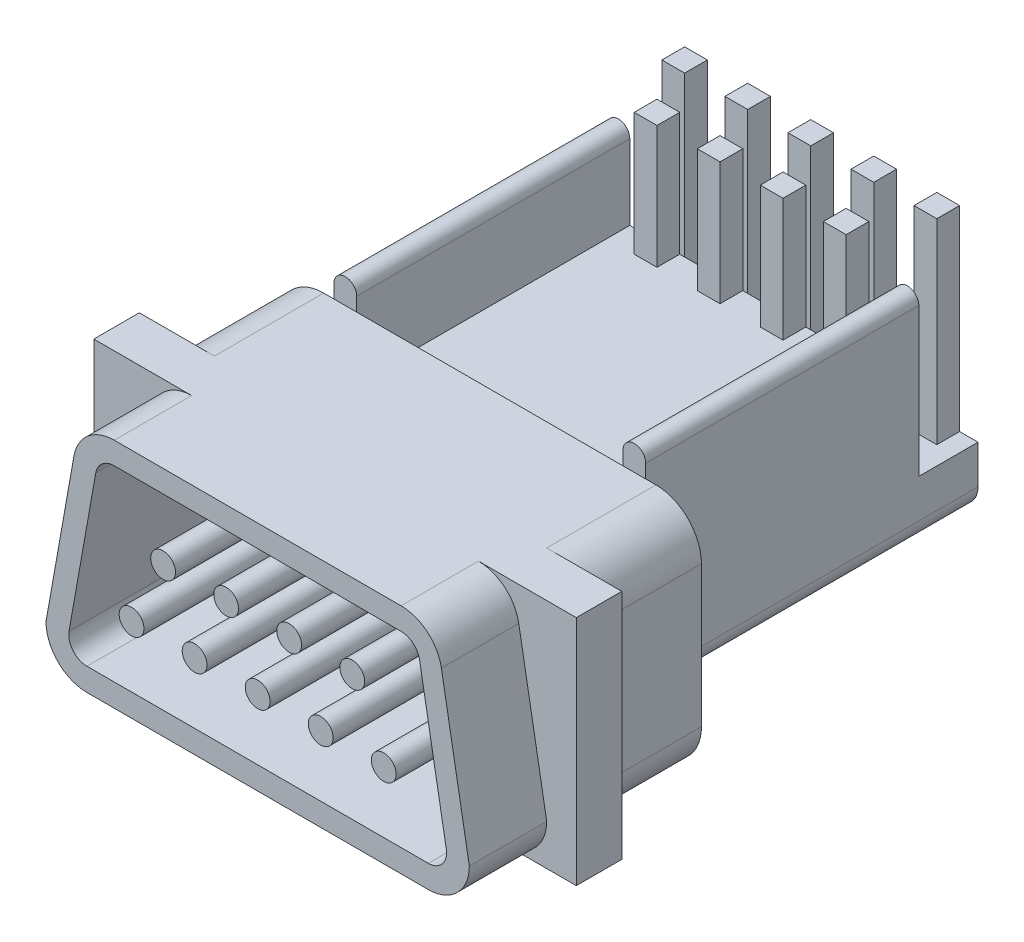
from build123d import *

# Parameters (mm, degrees)
SKETCH_1_W          = 21.2
SKETCH_1_H          = 10.2
EXTRUDE_1_DEPTH     = 2
EXTRUDE_2_DEPTH     = 3.4
EXTRUDE_3_DEPTH     = 4.8
EXTRUDE_4_DEPTH     = 12
EXTRUDE_5_DEPTH     = 2.6
SKETCH_6_R          = 0.545
CUT_EXTRUDE_1_DEPTH = 7
SKETCH_7_W          = 1
SKETCH_7_H          = 1
EXTRUDE_6_DEPTH     = 8.6
SKETCH_8_W          = 1
SKETCH_8_H          = 1
EXTRUDE_7_DEPTH     = 5.4


with BuildPart() as part:
    # Эскиз1 → Бобышка-Вытянуть1 (new body)
    with BuildSketch(Plane.XY):
        Rectangle(SKETCH_1_W, SKETCH_1_H)
    extrude(amount=EXTRUDE_1_DEPTH)

    # Эскиз2 → Бобышка-Вытянуть2 (add)
    with BuildSketch(Plane.XY.offset(2)):
        with BuildLine():
            Line((-6.3, 5.1), (6.3, 5.1))
            ThreePointArc((6.3, 5.1), (7.4561981, 4.679567307), (8.072281221, 3.614673282))
            Line((8.072281221, 3.614673282), (9.3, -3.3))
            ThreePointArc((9.3, -3.3), (8.772792206, -4.572792206), (7.5, -5.1))
            Line((7.5, -5.1), (-7.5, -5.1))
            ThreePointArc((-7.5, -5.1), (-8.772792206, -4.572792206), (-9.3, -3.3))
            Line((-9.3, -3.3), (-8.072281221, 3.614673282))
            ThreePointArc((-8.072281221, 3.614673282), (-7.4561981, 4.679567307), (-6.3, 5.1))
        make_face()
    extrude(amount=EXTRUDE_2_DEPTH)

    # Эскиз3 → Бобышка-Вытянуть3 (add)
    with BuildSketch(Plane(origin=(0, 0, 0), x_dir=(-1, 0, 0), z_dir=(0, 0, -1))):
        with BuildLine():
            Line((7.3, -5.1), (-7.3, -5.1))
            ThreePointArc((-7.3, -5.1), (-8.714213562, -4.514213562), (-9.3, -3.1))
            Line((-9.3, -3.1), (-9.3, 3.1))
            ThreePointArc((-9.3, 3.1), (-8.714213562, 4.514213562), (-7.3, 5.1))
            Line((-7.3, 5.1), (7.3, 5.1))
            ThreePointArc((7.3, 5.1), (8.714213562, 4.514213562), (9.3, 3.1))
            Line((9.3, 3.1), (9.3, -3.1))
            ThreePointArc((9.3, -3.1), (8.714213562, -4.514213562), (7.3, -5.1))
        make_face()
    extrude(amount=EXTRUDE_3_DEPTH)

    # Эскиз4 → Бобышка-Вытянуть4 (add)
    with BuildSketch(Plane(origin=(0, 0, -4.8), x_dir=(-1, 0, 0), z_dir=(0, 0, -1))):
        with BuildLine():
            Line((4.85, -2.5), (-4.85, -2.5))
            ThreePointArc((-4.85, -2.5), (-5.85, -3.5), (-6.85, -2.5))
            Line((-6.85, -2.5), (-6.85, 5.7))
            ThreePointArc((-6.85, 5.7), (-6.35, 6.2), (-5.85, 5.7))
            Line((-5.85, 5.7), (-5.85, 2.4))
            Line((-5.85, 2.4), (5.85, 2.4))
            Line((5.85, 2.4), (5.85, 5.7))
            ThreePointArc((5.85, 5.7), (6.35, 6.2), (6.85, 5.7))
            Line((6.85, 5.7), (6.85, -2.5))
            ThreePointArc((6.85, -2.5), (5.85, -3.5), (4.85, -2.5))
        make_face()
    extrude(amount=EXTRUDE_4_DEPTH)

    # Эскиз5 → Бобышка-Вытянуть5 (add)
    with BuildSketch(Plane(origin=(0, 0, -16.8), x_dir=(-1, 0, 0), z_dir=(0, 0, -1))):
        with BuildLine():
            Line((6.85, -0.8), (-6.85, -0.8))
            Line((-6.85, -0.8), (-6.85, -2.5))
            ThreePointArc((-6.85, -2.5), (-5.85, -3.5), (-4.85, -2.5))
            Line((-4.85, -2.5), (4.85, -2.5))
            ThreePointArc((4.85, -2.5), (5.85, -3.5), (6.85, -2.5))
            Line((6.85, -2.5), (6.85, -0.8))
        make_face()
    extrude(amount=EXTRUDE_5_DEPTH)

    # Эскиз6 → Вырез-Вытянуть1 (cut)
    with BuildSketch(Plane.XY.offset(5.4)):
        with BuildLine():
            Line((7.5, -4.1), (-7.5, -4.1))
            ThreePointArc((-7.5, -4.1), (-8.113141025, -3.813865822), (-8.287680543, -3.160145208))
            Line((-8.287680543, -3.160145208), (-7.114972471, 3.444700547))
            ThreePointArc((-7.114972471, 3.444700547), (-6.831670489, 3.934385426), (-6.3, 4.127718779))
            Line((-6.3, 4.127718779), (6.3, 4.127718779))
            ThreePointArc((6.3, 4.127718779), (6.831670489, 3.934385426), (7.114972471, 3.444700547))
            Line((7.114972471, 3.444700547), (8.287680543, -3.160145208))
            ThreePointArc((8.287680543, -3.160145208), (8.113141025, -3.813865822), (7.5, -4.1))
        make_face()
        with Locations((0, -1.42)):
            Circle(SKETCH_6_R, mode=Mode.SUBTRACT)
        with Locations((-2.77, -1.42)):
            Circle(SKETCH_6_R, mode=Mode.SUBTRACT)
        with Locations((-5.54, -1.42)):
            Circle(SKETCH_6_R, mode=Mode.SUBTRACT)
        with Locations((2.77, -1.42)):
            Circle(SKETCH_6_R, mode=Mode.SUBTRACT)
        with Locations((5.54, -1.42)):
            Circle(SKETCH_6_R, mode=Mode.SUBTRACT)
        with Locations((1.385, 1.42)):
            Circle(SKETCH_6_R, mode=Mode.SUBTRACT)
        with Locations((-1.385, 1.42)):
            Circle(SKETCH_6_R, mode=Mode.SUBTRACT)
        with Locations((-4.155, 1.42)):
            Circle(SKETCH_6_R, mode=Mode.SUBTRACT)
        with Locations((4.155, 1.42)):
            Circle(SKETCH_6_R, mode=Mode.SUBTRACT)
    extrude(amount=-CUT_EXTRUDE_1_DEPTH, mode=Mode.SUBTRACT)

    # Эскиз7 → Бобышка-Вытянуть6 (add)
    with BuildSketch(Plane(origin=(0, -0.8, 0), x_dir=(1, 0, 0), z_dir=(0, 1, 0))):
        with Locations((0, 18.9)):
            Rectangle(SKETCH_7_W, SKETCH_7_H)
        with Locations((2.77, 18.9)):
            Rectangle(SKETCH_7_W, SKETCH_7_H)
        with Locations((5.54, 18.9)):
            Rectangle(SKETCH_7_W, SKETCH_7_H)
        with Locations((-2.77, 18.9)):
            Rectangle(SKETCH_7_W, SKETCH_7_H)
        with Locations((-5.54, 18.9)):
            Rectangle(SKETCH_7_W, SKETCH_7_H)
    extrude(amount=EXTRUDE_6_DEPTH)

    # Эскиз8 → Бобышка-Вытянуть7 (add)
    with BuildSketch(Plane(origin=(0, 2.4, 0), x_dir=(1, 0, 0), z_dir=(0, 1, 0))):
        with Locations((-1.385, 16.3)):
            Rectangle(SKETCH_8_W, SKETCH_8_H)
        with Locations((1.385, 16.3)):
            Rectangle(SKETCH_8_W, SKETCH_8_H)
        with Locations((4.155, 16.3)):
            Rectangle(SKETCH_8_W, SKETCH_8_H)
        with Locations((-4.155, 16.3)):
            Rectangle(SKETCH_8_W, SKETCH_8_H)
    extrude(amount=EXTRUDE_7_DEPTH)


solid = part.part
